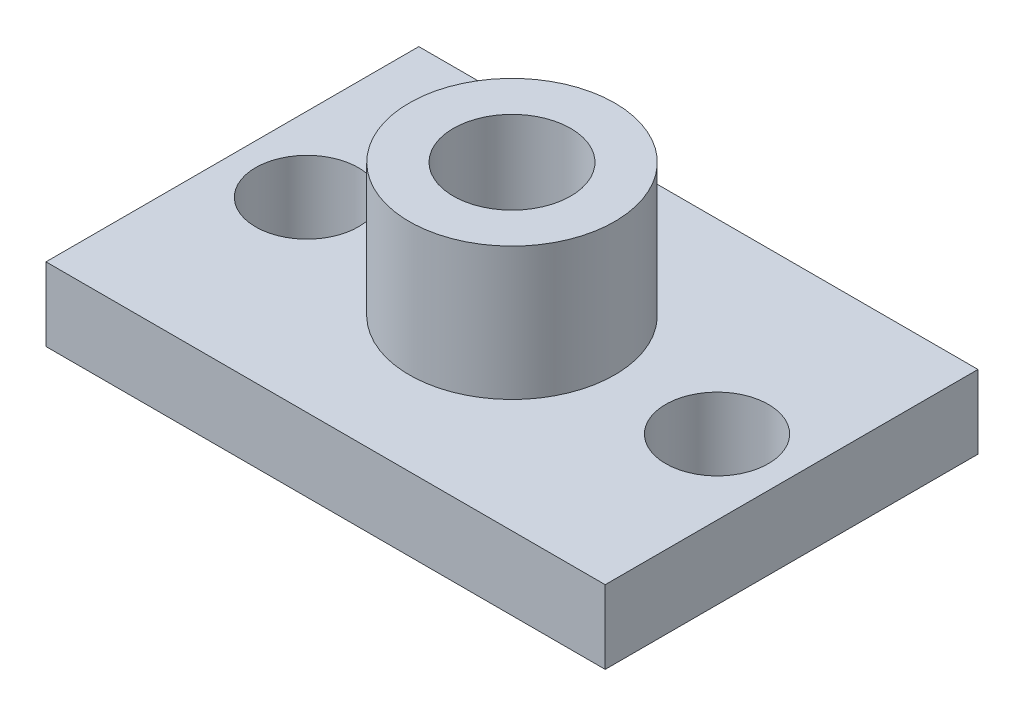
from build123d import *

# Parameters (mm, degrees)
SKETCH1_W           = 38.1
SKETCH1_H           = 25.4
BOSS_EXTRUDE1_DEPTH = 5
SKETCH3_R           = 7
SKETCH3_R_2         = 4
BOSS_EXTRUDE2_DEPTH = 9.05
SKETCH4_R           = 3.5
CUT_EXTRUDE1_DEPTH  = 31.182577446


with BuildPart() as part:
    # Sketch1 → Boss-Extrude1 (new body)
    with BuildSketch(Plane(origin=(0, 0, 0), x_dir=(1, 0, 0), z_dir=(0, 1, 0))):
        with Locations((-6.79173913, 0)):
            Rectangle(SKETCH1_W, SKETCH1_H)
    extrude(amount=BOSS_EXTRUDE1_DEPTH)

    # Sketch3 → Boss-Extrude2 (add)
    with BuildSketch(Plane(origin=(0, 5, 0), x_dir=(1, 0, 0), z_dir=(0, 1, 0))):
        with Locations((-6.79173913, 0)):
            Circle(SKETCH3_R)
        with Locations((-6.79173913, 0)):
            Circle(SKETCH3_R_2, mode=Mode.SUBTRACT)
    extrude(amount=BOSS_EXTRUDE2_DEPTH)

    # Sketch4 → Cut-Extrude1 (cut, through all)
    with BuildSketch(Plane(origin=(0, 5, 0), x_dir=(1, 0, 0), z_dir=(0, 1, 0))):
        with Locations((7.17826087, 0)):
            Circle(SKETCH4_R)
        with Locations((-20.76173913, 0)):
            Circle(SKETCH4_R)
    extrude(amount=-CUT_EXTRUDE1_DEPTH, mode=Mode.SUBTRACT)


solid = part.part
